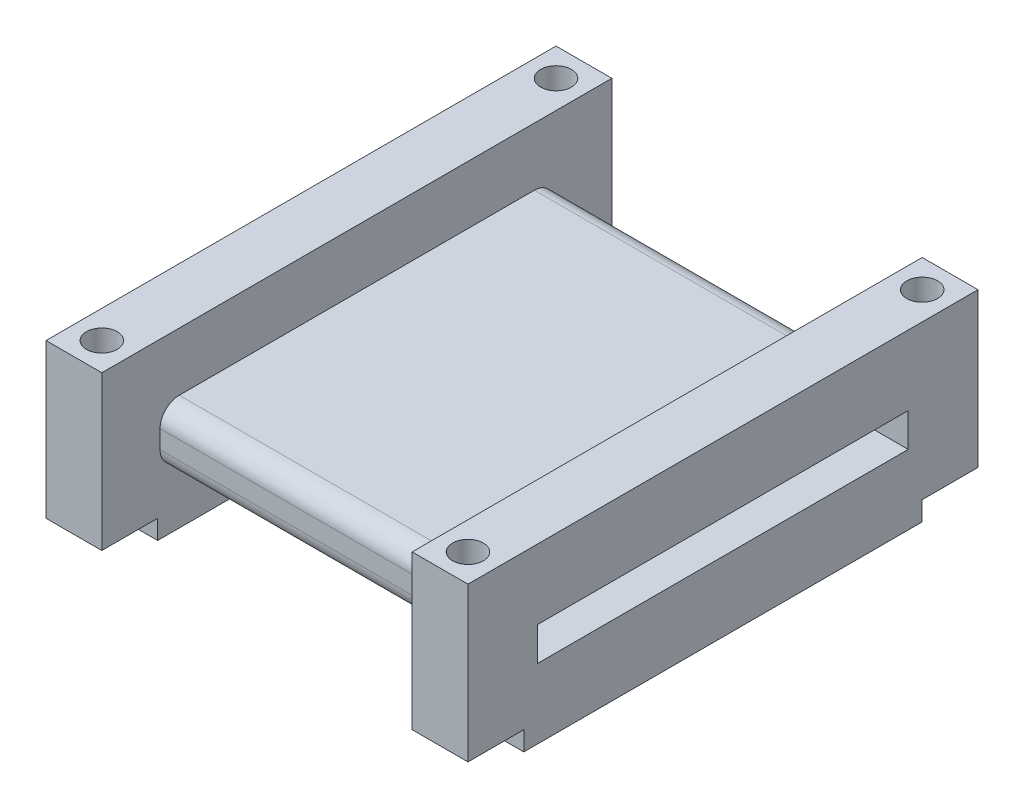
from build123d import *

# Parameters (mm, degrees)
SKETCH1_W           = 40.9
SKETCH1_H           = 5.9
SKETCH1_W_2         = 38.5
SKETCH1_H_2         = 3.5
BOSS_EXTRUDE1_DEPTH = 32.25
FILLET2_R           = 2
SKETCH2_W           = 53
SKETCH2_H           = 18
SKETCH2_W_2         = 38.5
SKETCH2_H_2         = 3.5
BOSS_EXTRUDE2_DEPTH = 5.8
SKETCH3_W           = 53
SKETCH3_H           = 18
SKETCH3_W_2         = 38.5
SKETCH3_H_2         = 3.5
BOSS_EXTRUDE3_DEPTH = 5.8
SKETCH4_R           = 1.6
CUT_EXTRUDE1_DEPTH  = 64.056363676
SKETCH15_W          = 38.5
SKETCH15_H          = 3.5
SKETCH15_W_2        = 5.8
SKETCH15_H_2        = 2
CUT_EXTRUDE5_DEPTH  = 66.344682263


with BuildPart() as part:
    # Sketch1 → Boss-Extrude1 (new body)
    with BuildSketch(Plane(origin=(0, 0, 0), x_dir=(0, 0, -1), z_dir=(1, 0, 0))):
        with Locations((20.45, 2.95)):
            Rectangle(SKETCH1_W, SKETCH1_H)
        with Locations((20.45, 2.95)):
            Rectangle(SKETCH1_W_2, SKETCH1_H_2, mode=Mode.SUBTRACT)
    extrude(amount=BOSS_EXTRUDE1_DEPTH)

    # Fillet2
    fillet2_edges = [part.edges().sort_by_distance(p)[0] for p in [
        (16.125, 0, -40.9),
        (16.125, 0, 0),
        (16.125, 5.9, 0),
        (16.125, 5.9, -40.9),
    ]]
    fillet(fillet2_edges, radius=FILLET2_R)

    # Sketch2 → Boss-Extrude2 (add)
    with BuildSketch(Plane(origin=(32.25, 0, 0), x_dir=(0, 0, -1), z_dir=(1, 0, 0))):
        with Locations((20.45, 2.95)):
            Rectangle(SKETCH2_W, SKETCH2_H)
        with Locations((20.45, 2.95)):
            Rectangle(SKETCH2_W_2, SKETCH2_H_2, mode=Mode.SUBTRACT)
    extrude(amount=BOSS_EXTRUDE2_DEPTH)

    # Sketch3 → Boss-Extrude3 (add)
    with BuildSketch(Plane.ZY):
        with Locations((-20.45, 2.95)):
            Rectangle(SKETCH3_W, SKETCH3_H)
        with Locations((-20.45, 2.95)):
            Rectangle(SKETCH3_W_2, SKETCH3_H_2, mode=Mode.SUBTRACT)
    extrude(amount=BOSS_EXTRUDE3_DEPTH)

    # Sketch4 → Cut-Extrude1 (cut, through all)
    with BuildSketch(Plane(origin=(0, 11.95, 0), x_dir=(1, 0, 0), z_dir=(0, 1, 0))):
        with Locations((-2.9, 44.05)):
            Circle(SKETCH4_R)
        with Locations((35.15, 44.05)):
            Circle(SKETCH4_R)
        with Locations((-2.9, -3.15)):
            Circle(SKETCH4_R)
        with Locations((35.15, -3.15)):
            Circle(SKETCH4_R)
    extrude(amount=-CUT_EXTRUDE1_DEPTH, mode=Mode.SUBTRACT)

    # Sketch15 → Cut-Extrude5 (cut, through all)
    with BuildSketch(Plane.ZY.offset(5.8)):
        with Locations((-20.45, 2.95)):
            Rectangle(SKETCH15_W, SKETCH15_H)
        with Locations((-44.05, -5.05)):
            Rectangle(SKETCH15_W_2, SKETCH15_H_2)
        with Locations((3.15, -5.05)):
            Rectangle(SKETCH15_W_2, SKETCH15_H_2)
    extrude(amount=-CUT_EXTRUDE5_DEPTH, mode=Mode.SUBTRACT)


solid = part.part
